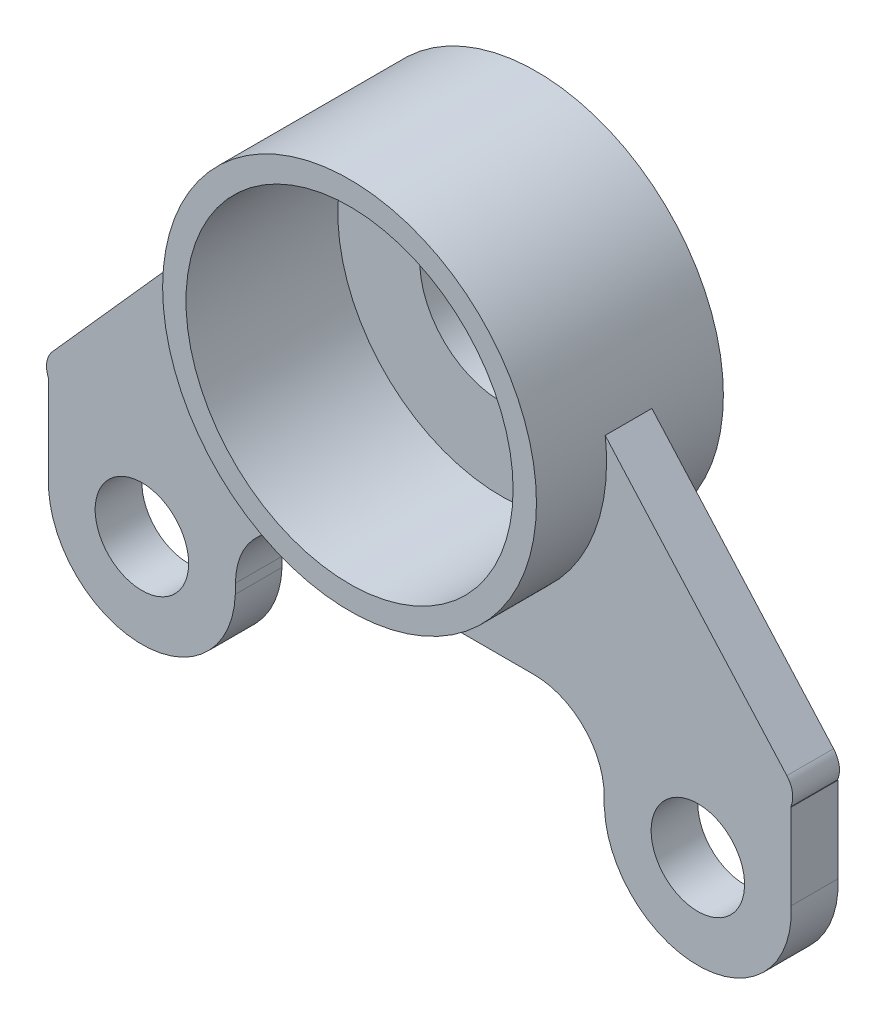
from build123d import *

# Parameters (mm, degrees)
BOSS_EXTRUDE1_DEPTH      = 4
FILLET1_R                = 8
FILLET2_R                = 2
SKETCH3_W                = 16
SKETCH3_H                = 8
BOSS_EXTRUDE2_DEPTH      = 4
SKETCH10_R               = 8
BOSS_EXTRUDE3_DEPTH      = 4
FILLET3_R                = 6
SKETCH11_R               = 4
CUT_EXTRUDE2_DEPTH       = 4
FILLET3_OF_MIRROR1_R     = 6
BOSS_EXTRUDE4_DEPTH      = 6
BOSS_EXTRUDE4_DEPTH_BACK = 10
SKETCH8_R                = 16
SKETCH13_R               = 14
CUT_EXTRUDE3_DEPTH       = 13
SKETCH17_R               = 7
CUT_EXTRUDE4_DEPTH       = 13


with BuildPart() as part:
    # Sketch2 → Boss-Extrude1 (new body)
    with BuildSketch(Plane.XY):
        Polygon((-24.718317205, 0), (44.079761222, 0), (9.680722008, 38.594041061), align=None)
    extrude(amount=BOSS_EXTRUDE1_DEPTH)

    # Fillet1
    fillet1_edges = [part.edges().sort_by_distance(p)[0] for p in [
        (9.680722008, 38.594041061, 2),
    ]]
    fillet(fillet1_edges, radius=FILLET1_R)

    # Fillet2
    fillet2_edges = [part.edges().sort_by_distance(p)[0] for p in [
        (44.079761222, 0, 2),
        (-24.718317205, 0, 2),
    ]]
    fillet(fillet2_edges, radius=FILLET2_R)

    # Sketch3 → Boss-Extrude2 (add)
    with BuildSketch(Plane.XY):
        with Locations((-14.081618267, -2.818082449)):
            Rectangle(SKETCH3_W, SKETCH3_H)
    boss_extrude2 = extrude(amount=BOSS_EXTRUDE2_DEPTH)

    # Sketch10 → Boss-Extrude3 (add)
    with BuildSketch(Plane.XY.offset(4)):
        with Locations((-14.092338513, -6.548407243)):
            Circle(SKETCH10_R)
    boss_extrude3 = extrude(amount=-BOSS_EXTRUDE3_DEPTH)

    # Fillet3
    fillet3_edges = [part.edges().sort_by_distance(p)[0] for p in [
        (-6.081618267, 0, 2),
    ]]
    fillet(fillet3_edges, radius=FILLET3_R)

    # Sketch11 → Cut-Extrude2 (cut)
    with BuildSketch(Plane.XY.offset(4)):
        with Locations((-14.092338513, -6.548407243)):
            Circle(SKETCH11_R)
    cut_extrude2 = extrude(amount=-CUT_EXTRUDE2_DEPTH, mode=Mode.SUBTRACT)

    # Mirror1: Boss-Extrude2, Boss-Extrude3, Cut-Extrude2 across plane
    add(boss_extrude2.mirror(Plane(origin=(9.7, 0, 0), x_dir=(0, 0, 1), z_dir=(1, 0, 0))))
    add(boss_extrude3.mirror(Plane(origin=(9.7, 0, 0), x_dir=(0, 0, 1), z_dir=(1, 0, 0))))
    add(cut_extrude2.mirror(Plane(origin=(9.7, 0, 0), x_dir=(0, 0, 1), z_dir=(1, 0, 0))), mode=Mode.SUBTRACT)

    # Fillet3 of Mirror1
    fillet3_of_mirror1_edges = [part.edges().sort_by_distance(p)[0] for p in [
        (25.481618267, 0, 2),
    ]]
    fillet(fillet3_of_mirror1_edges, radius=FILLET3_OF_MIRROR1_R)

    # Sketch8 → Boss-Extrude4 (add, two sides: drawn at the far end of the back side and taken through both)
    with BuildSketch(Plane.XY.offset(4).offset(-BOSS_EXTRUDE4_DEPTH_BACK)):
        with Locations((9.680722008, 18.821374391)):
            Circle(SKETCH8_R)
    extrude(amount=BOSS_EXTRUDE4_DEPTH + BOSS_EXTRUDE4_DEPTH_BACK)

    # Sketch13 → Cut-Extrude3 (cut)
    with BuildSketch(Plane.XY.offset(10)):
        with Locations((9.680722008, 18.821374391)):
            Circle(SKETCH13_R)
    extrude(amount=-CUT_EXTRUDE3_DEPTH, mode=Mode.SUBTRACT)

    # Sketch17 → Cut-Extrude4 (cut)
    with BuildSketch(Plane.XY.offset(-3)):
        with Locations((9.680722008, 18.821374391)):
            Circle(SKETCH17_R)
    extrude(amount=-CUT_EXTRUDE4_DEPTH, mode=Mode.SUBTRACT)


solid = part.part
